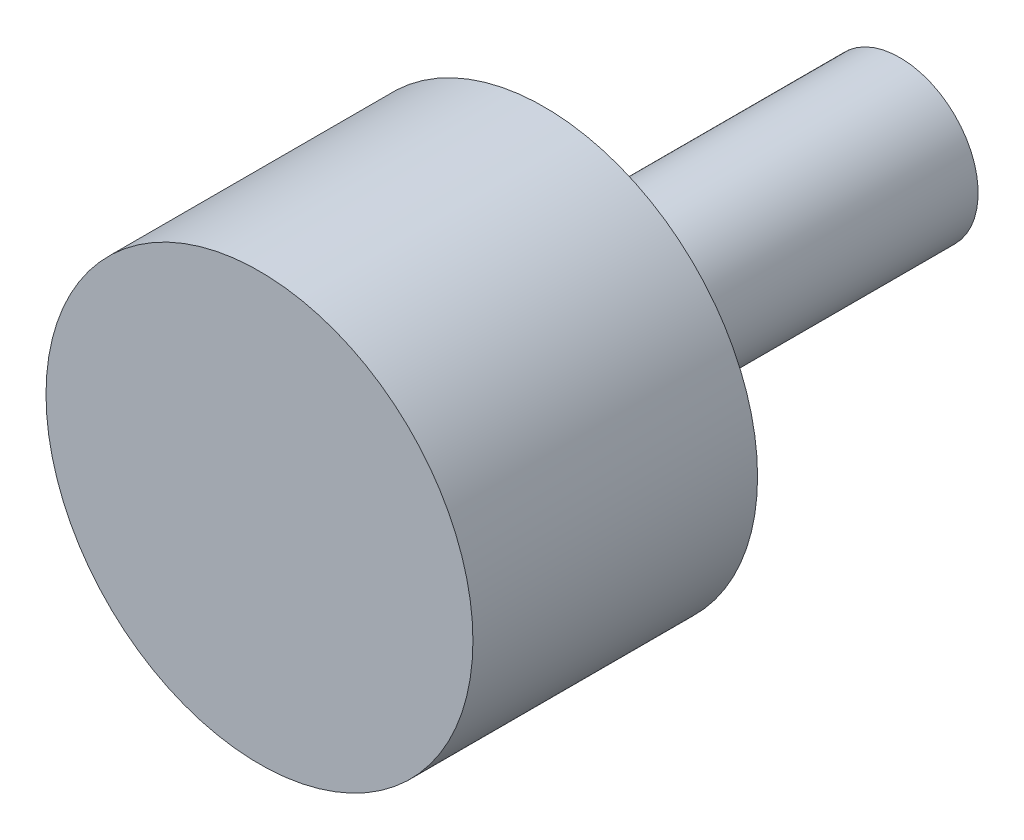
from build123d import *

# Parameters (mm, degrees)
SKETCH1_R           = 15
BOSS_EXTRUDE1_DEPTH = 20
SKETCH2_R           = 5.5
BOSS_EXTRUDE2_DEPTH = 25


with BuildPart() as part:
    # Sketch1 → Boss-Extrude1 (new body)
    with BuildSketch(Plane.XY):
        Circle(SKETCH1_R)
    extrude(amount=BOSS_EXTRUDE1_DEPTH)

    # Sketch2 → Boss-Extrude2 (add)
    with BuildSketch(Plane(origin=(0, 0, 0), x_dir=(-1, 0, 0), z_dir=(0, 0, -1))):
        Circle(SKETCH2_R)
    extrude(amount=BOSS_EXTRUDE2_DEPTH)


solid = part.part
